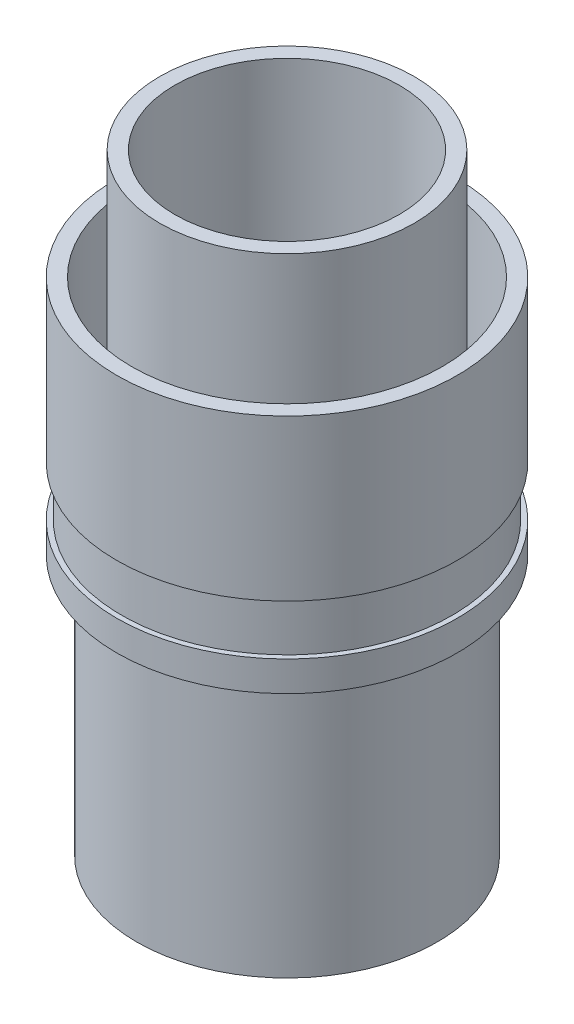
from build123d import *

# Parameters (mm, degrees)
KES_EKSTR_ZYON1_START = -30
IZIM2_R               = 15.5
IZIM2_R_2             = 12.7
IZIM2_R_3             = 11.2
KES_EKSTR_ZYON1_DEPTH = 30
IZIM3_R               = 13.5
KES_EKSTR_ZYON2_DEPTH = 30


with BuildPart() as part:
    # Çizim1 → Döndür1 (revolve)
    with BuildSketch(Plane.XY, mode=Mode.PRIVATE) as d_nd_r1_sk:
        Polygon((-20.912241055, -5.436911488), (-20.912241055, 55.563088512), (-33.612241055, 55.563088512), (-33.612241055, 44.563088512), (-37.912241055, 44.563088512), (-37.912241055, 28.563088512), (-37.412241055, 28.563088512), (-37.412241055, 23.563088512), (-37.912241055, 23.563088512), (-37.912241055, 20.563088512), (-35.912241055, 20.563088512), (-35.912241055, -5.436911488), align=None)
    revolve(d_nd_r1_sk.sketch.rotate(Axis((-20.912241055, -5.436911488, 0), (0, 1, 0)), 270), axis=Axis((-20.912241055, -5.436911488, 0), (0, 1, 0)))

    # Çizim2 → Kes-Ekstrüzyon1 (cut)
    # profile 1 of 2: a face of its own
    with BuildSketch(Plane(origin=(0, 55.563088512, 0), x_dir=(1, 0, 0), z_dir=(0, 1, 0)).offset(KES_EKSTR_ZYON1_START)):
        with Locations(Location((-20.912241055, 0, 0), (0, 0, 270))):
            Circle(IZIM2_R)
        with Locations(Location((-20.912241055, 0, 0), (0, 0, 90))):
            Circle(IZIM2_R_2, mode=Mode.SUBTRACT)
    # profile 2 of 2: a face of its own
    with BuildSketch(Plane(origin=(0, 55.563088512, 0), x_dir=(1, 0, 0), z_dir=(0, 1, 0)).offset(KES_EKSTR_ZYON1_START)):
        with Locations(Location((-20.912241055, 0, 0), (0, 0, 270))):
            Circle(IZIM2_R_3)
    extrude(amount=KES_EKSTR_ZYON1_DEPTH, mode=Mode.SUBTRACT)

    # Çizim3 → Kes-Ekstrüzyon2 (cut)
    with BuildSketch(Plane.XZ.offset(5.436911488)):
        with Locations(Location((-20.912241055, 0, 0), (0, 0, 270))):
            Circle(IZIM3_R)
    extrude(amount=-KES_EKSTR_ZYON2_DEPTH, mode=Mode.SUBTRACT)


solid = part.part
